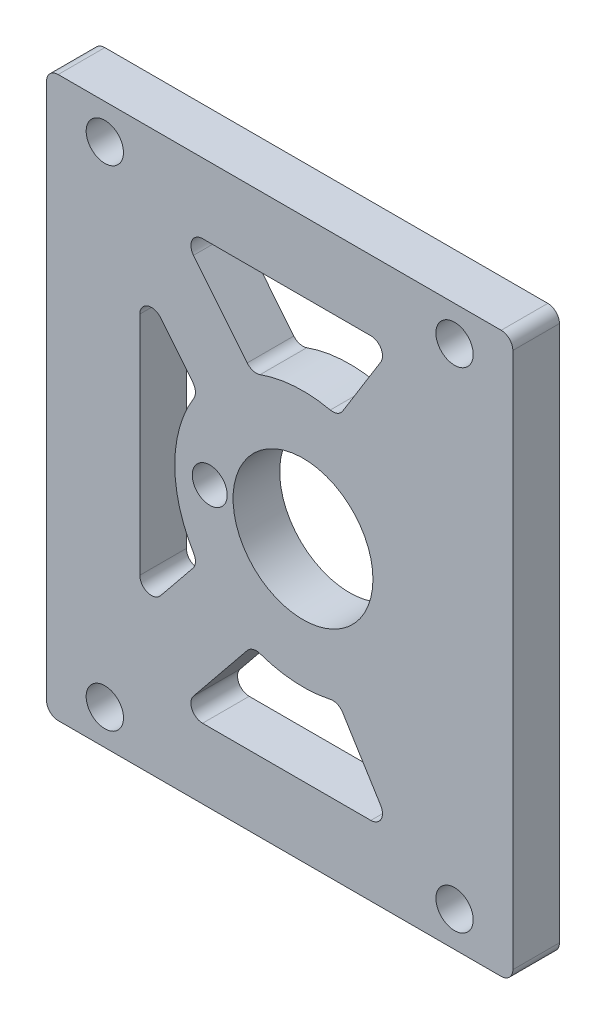
from build123d import *

# Parameters (mm, degrees)
SKETCH_1_W          = 40
SKETCH_1_H          = 48
SKETCH_1_R          = 1.6
SKETCH_1_R_2        = 6
EXTRUDE_1_DEPTH     = 4
SKETCH_3_R          = 1.5
CUT_EXTRUDE_1_DEPTH = 63.60990337
CUT_EXTRUDE_2_DEPTH = 10
FILLET_1_R          = 1


with BuildPart() as part:
    # ｽｹｯﾁ1 → ﾎﾞｽ - 押し出し1 (new body)
    with BuildSketch(Plane.XY):
        with Locations((20, 24)):
            Rectangle(SKETCH_1_W, SKETCH_1_H)
        with Locations((5, 45)):
            Circle(SKETCH_1_R, mode=Mode.SUBTRACT)
        with Locations((5, 3)):
            Circle(SKETCH_1_R, mode=Mode.SUBTRACT)
        with Locations((35, 45)):
            Circle(SKETCH_1_R, mode=Mode.SUBTRACT)
        with Locations((35, 3)):
            Circle(SKETCH_1_R, mode=Mode.SUBTRACT)
        with Locations((22, 24)):
            Circle(SKETCH_1_R_2, mode=Mode.SUBTRACT)
    extrude(amount=EXTRUDE_1_DEPTH)

    # ｽｹｯﾁ3 → ｶｯﾄ - 押し出し1 (cut, through all)
    with BuildSketch(Plane.XY.offset(4)):
        with Locations((14, 24)):
            Circle(SKETCH_3_R)
    extrude(amount=-CUT_EXTRUDE_1_DEPTH, mode=Mode.SUBTRACT)

    # ｽｹｯﾁ4 → ｶｯﾄ - 押し出し2 (cut)
    with BuildSketch(Plane(origin=(0, 0, 0), x_dir=(-1, 0, 0), z_dir=(0, 0, -1))):
        with BuildLine():
            Line((-29.61454599, 42), (-25.019618207, 34.57742435))
            ThreePointArc((-25.019618207, 34.57742435), (-21.306285158, 34.978103649), (-17.672926458, 34.113181229))
            Line((-17.672926458, 34.113181229), (-11.288358882, 42))
            Line((-11.288358882, 42), (-29.61454599, 42))
        make_face()
        with BuildLine():
            ThreePointArc((-11, 24), (-11.514391519, 20.675542933), (-13.009457234, 17.662008143))
            Line((-13.009457234, 17.662008143), (-8, 11.473855089))
            Line((-8, 11.473855089), (-8, 36.526144911))
            Line((-8, 36.526144911), (-13.009457234, 30.337991857))
            ThreePointArc((-13.009457234, 30.337991857), (-11.514391519, 27.324457067), (-11, 24))
        make_face()
        with BuildLine():
            ThreePointArc((-17.672926458, 13.886818771), (-21.306285158, 13.021896351), (-25.019618207, 13.42257565))
            Line((-25.019618207, 13.42257565), (-29.61454599, 6))
            Line((-29.61454599, 6), (-11.288358882, 6))
            Line((-11.288358882, 6), (-17.672926458, 13.886818771))
        make_face()
    extrude(amount=-CUT_EXTRUDE_2_DEPTH, mode=Mode.SUBTRACT)

    # ﾌｨﾚｯﾄ1
    fillet_1_edges = [part.edges().sort_by_distance(p)[0] for p in [
        (13.009457234, 17.662008143, 2),
        (13.009457234, 30.337991857, 2),
        (8, 36.526144911, 2),
        (8, 11.473855089, 2),
        (25.019618207, 13.42257565, 2),
        (17.672926458, 13.886818771, 2),
        (11.288358882, 6, 2),
        (29.61454599, 6, 2),
        (17.672926458, 34.113181229, 2),
        (25.019618207, 34.57742435, 2),
        (29.61454599, 42, 2),
        (11.288358882, 42, 2),
        (0, 48, 2),
        (40, 48, 2),
        (40, 0, 2),
        (0, 0, 2),
    ]]
    fillet(fillet_1_edges, radius=FILLET_1_R)


solid = part.part
